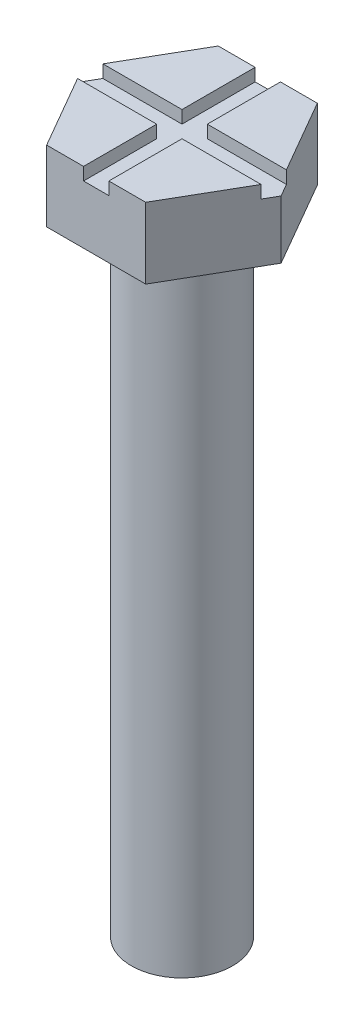
from build123d import *

# Parameters (mm, degrees)
BOSS_EXTRUDE1_DEPTH = 2.8
CUT_EXTRUDE1_DEPTH  = 0.5
SKETCH3_R           = 2
BOSS_EXTRUDE2_DEPTH = 25


with BuildPart() as part:
    # Sketch1 → Boss-Extrude1 (new body)
    with BuildSketch(Plane(origin=(0, 0, 0), x_dir=(1, 0, 0), z_dir=(0, 1, 0))):
        Polygon((1.957217413, -3.39), (3.914434825, 0), (1.957217413, 3.39), (-1.957217413, 3.39), (-3.914434825, 0), (-1.957217413, -3.39), align=None)
    extrude(amount=BOSS_EXTRUDE1_DEPTH)

    # Sketch2 → Cut-Extrude1 (cut)
    with BuildSketch(Plane(origin=(0, 2.8, 0), x_dir=(1, 0, 0), z_dir=(0, 1, 0))):
        Polygon((-0.5, 3.39), (0.5, 3.39), (0.5, 0.5), (3.914434825, 0.5), (3.914434825, -0.5), (0.5, -0.5), (0.5, -3.39), (-0.5, -3.39), (-0.5, -0.5), (-3.914434825, -0.5), (-3.914434825, 0.5), (-0.5, 0.5), align=None)
    extrude(amount=-CUT_EXTRUDE1_DEPTH, mode=Mode.SUBTRACT)

    # Sketch3 → Boss-Extrude2 (add)
    with BuildSketch(Plane.XZ):
        with Locations(Location((0, 0, 0), (0, 0, 270))):
            Circle(SKETCH3_R)
    extrude(amount=BOSS_EXTRUDE2_DEPTH)


solid = part.part
